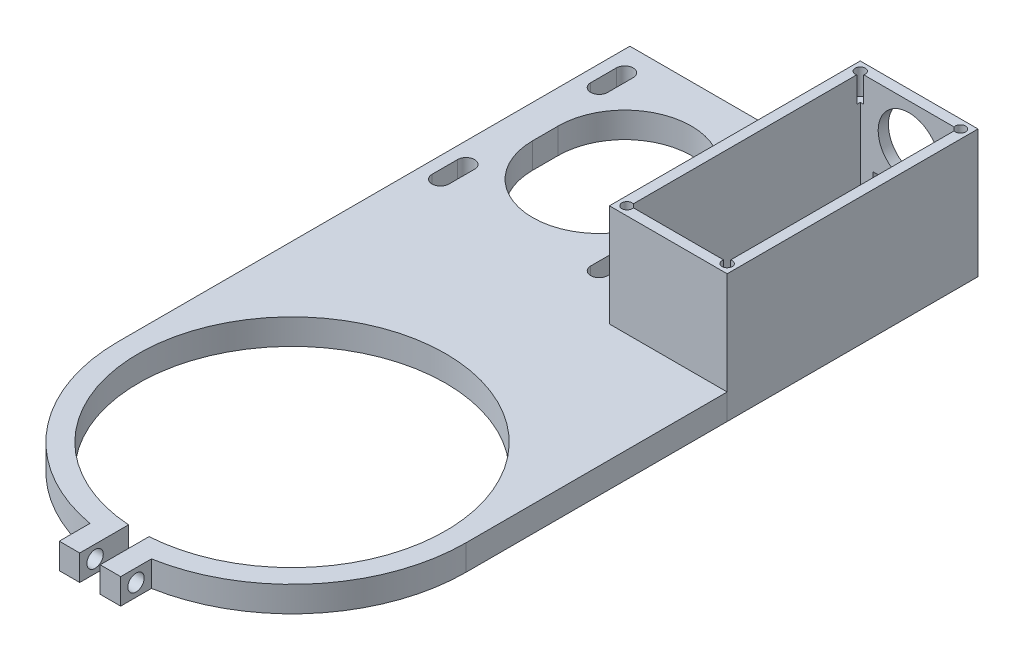
from build123d import *

# Parameters (mm, degrees)
EXTRUDE_1_DEPTH     = 5
SKETCH_4_R          = 1.6
CUT_EXTRUDE_1_DEPTH = 10
SKETCH_5_W          = 23
SKETCH_5_H          = 49
EXTRUDE_2_DEPTH     = 25
SHELL_1_T           = -2
SKETCH_6_R          = 6
SKETCH_6_W          = 14
SKETCH_6_H          = 7
CUT_EXTRUDE_2_DEPTH = 2
SKETCH_7_R          = 1
CUT_EXTRUDE_3_DEPTH = 5
SKETCH_10_R         = 1
CUT_EXTRUDE_4_DEPTH = 10


with BuildPart() as part:
    # 草图2 → 凸台-拉伸1 (new body)
    with BuildSketch(Plane(origin=(0, 0, 0), x_dir=(1, 0, 0), z_dir=(0, 1, 0))):
        with BuildLine():
            Line((6, -39.466401061), (6, -33.466401061))
            ThreePointArc((6, -33.466401061), (26.076809621, -21.817424229), (34, 0))
            Line((34, 0), (34, 51))
            Line((34, 51), (11, 51))
            Line((11, 51), (11, 100))
            Line((11, 100), (-34, 100))
            Line((-34, 100), (-34, 0))
            ThreePointArc((-34, 0), (-26.076809621, -21.817424229), (-6, -33.466401061))
            Line((-6, -33.466401061), (-6, -39.466401061))
            Line((-6, -39.466401061), (-2, -39.466401061))
            Line((-2, -39.466401061), (-2, -29.933259094))
            ThreePointArc((-2, -29.933259094), (0, 30), (2, -29.933259094))
            Line((2, -29.933259094), (2, -39.466401061))
            Line((2, -39.466401061), (6, -39.466401061))
        make_face()
        with BuildLine():
            ThreePointArc((-0.65, 90), (1, 88.35), (2.65, 90))
            Line((2.65, 90), (2.65, 95))
            ThreePointArc((2.65, 95), (1, 96.65), (-0.65, 95))
            Line((-0.65, 95), (-0.65, 90))
        make_face(mode=Mode.SUBTRACT)
        with BuildLine():
            ThreePointArc((-31.65, 90), (-30, 88.35), (-28.35, 90))
            Line((-28.35, 90), (-28.35, 95))
            ThreePointArc((-28.35, 95), (-30, 96.65), (-31.65, 95))
            Line((-31.65, 95), (-31.65, 90))
        make_face(mode=Mode.SUBTRACT)
        with BuildLine():
            ThreePointArc((-27.5, 74.5), (-14.5, 61.5), (-1.5, 74.5))
            Line((-1.5, 74.5), (-1.5, 79.5))
            ThreePointArc((-1.5, 79.5), (-14.5, 92.5), (-27.5, 79.5))
            Line((-27.5, 79.5), (-27.5, 74.5))
        make_face(mode=Mode.SUBTRACT)
        with BuildLine():
            ThreePointArc((-0.65, 59), (1, 57.35), (2.65, 59))
            Line((2.65, 59), (2.65, 64))
            ThreePointArc((2.65, 64), (1, 65.65), (-0.65, 64))
            Line((-0.65, 64), (-0.65, 59))
        make_face(mode=Mode.SUBTRACT)
        with BuildLine():
            ThreePointArc((-31.65, 59), (-30, 57.35), (-28.35, 59))
            Line((-28.35, 59), (-28.35, 64))
            ThreePointArc((-28.35, 64), (-30, 65.65), (-31.65, 64))
            Line((-31.65, 64), (-31.65, 59))
        make_face(mode=Mode.SUBTRACT)
    extrude(amount=EXTRUDE_1_DEPTH)

    # 草图4 → 切除-拉伸1 (cut, symmetric)
    with BuildSketch(Plane(origin=(0, 0, 0), x_dir=(0, 0, -1), z_dir=(1, 0, 0))):
        with Locations((-36.466401061, 2.5)):
            Circle(SKETCH_4_R)
    extrude(amount=CUT_EXTRUDE_1_DEPTH, both=True, mode=Mode.SUBTRACT)


with BuildPart() as body_2:
    # 草图5 → 凸台-拉伸2 (new body)
    with BuildSketch(Plane(origin=(0, 0, 0), x_dir=(1, 0, 0), z_dir=(0, 1, 0))):
        with Locations((22.5, 75.5)):
            Rectangle(SKETCH_5_W, SKETCH_5_H)
    extrude(amount=EXTRUDE_2_DEPTH)

    # 抽壳1
    shell_1_openings = [body_2.faces().sort_by_distance(p)[0] for p in [
        (22.5, 25, -75.5),
    ]]
    offset(amount=SHELL_1_T, openings=shell_1_openings, kind=Kind.INTERSECTION)

    # 草图6 → 切除-拉伸2 (cut)
    with BuildSketch(Plane(origin=(0, 0, -100), x_dir=(-1, 0, 0), z_dir=(0, 0, -1))):
        with Locations((-22.5, 17)):
            Circle(SKETCH_6_R)
        with Locations((-22.5, 6)):
            Rectangle(SKETCH_6_W, SKETCH_6_H)
    extrude(amount=-CUT_EXTRUDE_2_DEPTH, mode=Mode.SUBTRACT)

    # 草图7 → 切除-拉伸3 (cut)
    with BuildSketch(Plane(origin=(0, 25, 0), x_dir=(1, 0, 0), z_dir=(0, 1, 0))):
        with Locations((12.717157288, 52.717157288)):
            Circle(SKETCH_7_R)
        with Locations((32.282842712, 52.717157288)):
            Circle(SKETCH_7_R)
        with Locations((32.282842712, 98.282842712)):
            Circle(SKETCH_7_R)
        with Locations((12.717157288, 98.282842712)):
            Circle(SKETCH_7_R)
    extrude(amount=-CUT_EXTRUDE_3_DEPTH, mode=Mode.SUBTRACT)

    # 草图10 → 切除-拉伸4 (cut)
    with BuildSketch(Plane(origin=(0, 2, 0), x_dir=(1, 0, 0), z_dir=(0, 1, 0))):
        with Locations(Location((15, 95.75, 0), (0, 0, 270))):
            Circle(SKETCH_10_R)
        with Locations(Location((30, 95.75, 0), (0, 0, 90))):
            Circle(SKETCH_10_R)
        with Locations(Location((30, 55.25, 0), (0, 0, 270))):
            Circle(SKETCH_10_R)
        with Locations(Location((15, 55.25, 0), (0, 0, 90))):
            Circle(SKETCH_10_R)
    extrude(amount=-CUT_EXTRUDE_4_DEPTH, mode=Mode.SUBTRACT)


solid = Compound([part.part, body_2.part])
